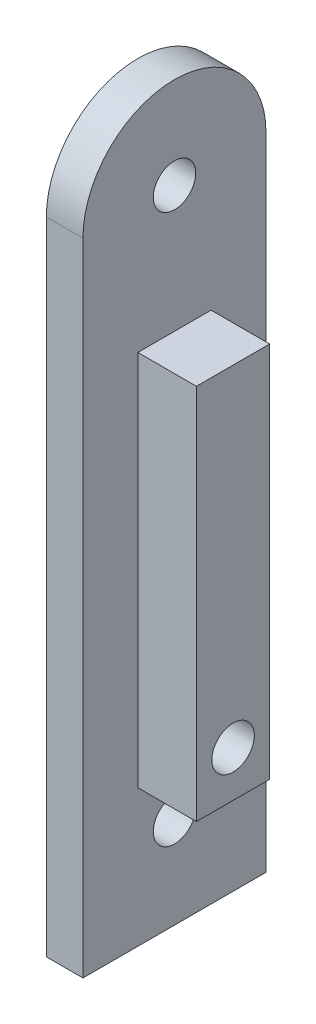
from build123d import *

# Parameters (mm, degrees)
BOSS_EXTRUDE1_DEPTH     = 2.54
SKETCH2_W               = 5.08
SKETCH2_H               = 26.152706233
BOSS_EXTRUDE2_DEPTH     = 4.064
CUT_EXTRUDE1_DEPTH      = 46.384334478
CUT_EXTRUDE1_DEPTH_BACK = 46.384334478
SKETCH3_R               = 1.4732
F_4_CLEARANCE_HOLE1_D   = 2.9464


with BuildPart() as part:
    # Sketch1 → Boss-Extrude1 (new body)
    with BuildSketch(Plane(origin=(0, 0, 0), x_dir=(0, 0, -1), z_dir=(1, 0, 0))):
        with BuildLine():
            Line((-6.35, 0), (-6.35, -44.45))
            Line((-6.35, -44.45), (6.35, -44.45))
            Line((6.35, -44.45), (6.35, 0))
            ThreePointArc((6.35, 0), (0, 6.35), (-6.35, 0))
        make_face()
    extrude(amount=BOSS_EXTRUDE1_DEPTH)

    # Sketch2 → Boss-Extrude2 (add)
    with BuildSketch(Plane(origin=(2.54, 0, 0), x_dir=(0, 0, -1), z_dir=(1, 0, 0))):
        with Locations((0, -21.848646884)):
            Rectangle(SKETCH2_W, SKETCH2_H)
    extrude(amount=BOSS_EXTRUDE2_DEPTH)

    # Sketch3 → Cut-Extrude1 (cut, two sides: drawn at the far end of the back side and taken through both)
    with BuildSketch(Plane.ZY.offset(-CUT_EXTRUDE1_DEPTH_BACK)):
        Circle(SKETCH3_R)
    extrude(amount=CUT_EXTRUDE1_DEPTH + CUT_EXTRUDE1_DEPTH_BACK, mode=Mode.SUBTRACT)

    # #4 Clearance Hole1 (through all)
    with Locations(Plane.ZY):
        with Locations((0, -31.75), (0, -38.1)):
            Hole(F_4_CLEARANCE_HOLE1_D / 2)


solid = part.part
